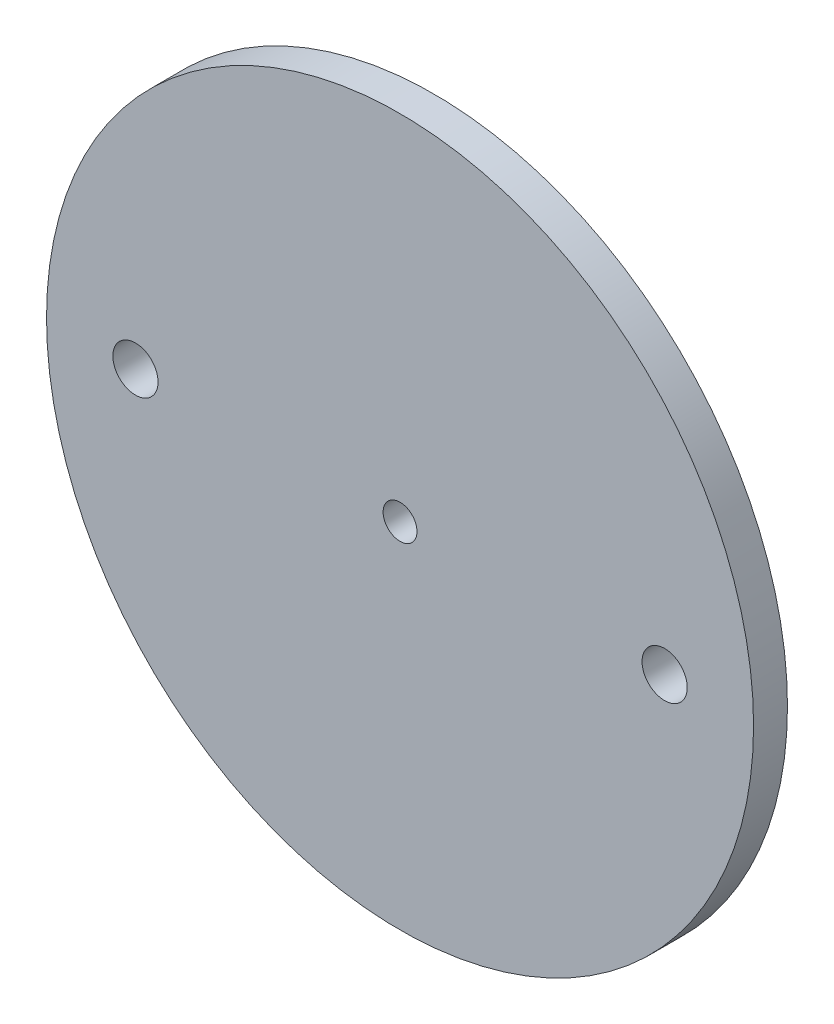
from build123d import *

# Parameters (mm, degrees)
SKETCH1_R           = 49.6697
BOSS_EXTRUDE1_DEPTH = 4.7625
SKETCH2_R           = 2.38125
SKETCH2_R_2         = 3.175
CUT_EXTRUDE1_DEPTH  = 71.404826556


with BuildPart() as part:
    # Sketch1 → Boss-Extrude1 (new body)
    with BuildSketch(Plane.XY):
        with Locations(Location((0, 0, 0), (0, 0, 180))):
            Circle(SKETCH1_R)
    extrude(amount=BOSS_EXTRUDE1_DEPTH)

    # Sketch2 → Cut-Extrude1 (cut, through all)
    with BuildSketch(Plane.XY.offset(4.7625)):
        Circle(SKETCH2_R)
        with Locations((37.1729, 0)):
            Circle(SKETCH2_R_2)
        with Locations((-37.1729, 0)):
            Circle(SKETCH2_R_2)
    extrude(amount=-CUT_EXTRUDE1_DEPTH, mode=Mode.SUBTRACT)


solid = part.part
